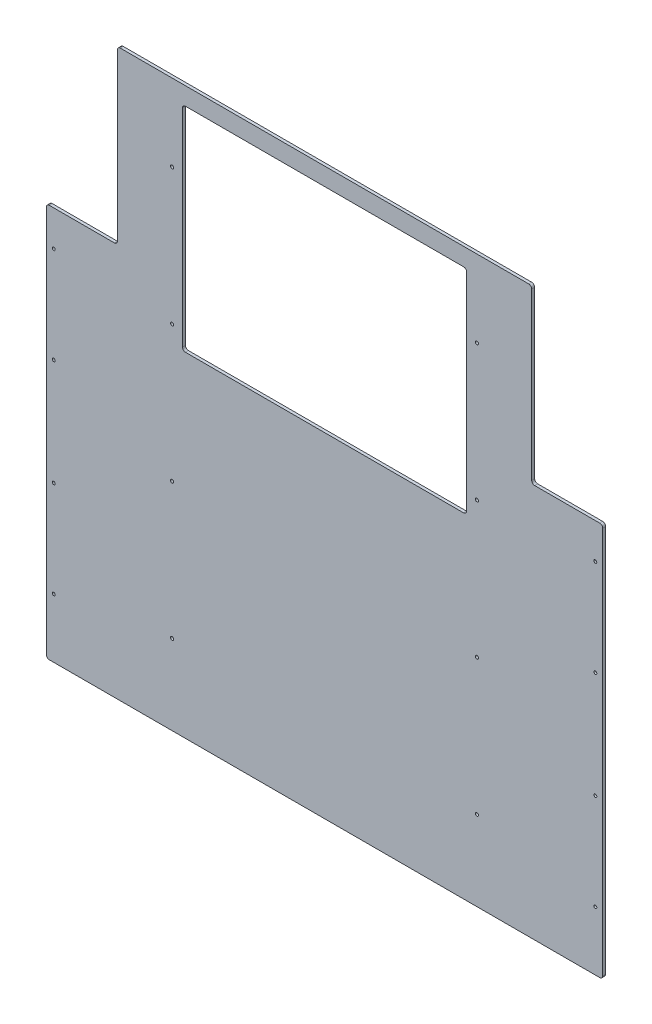
from build123d import *

# Parameters (mm, degrees)
SKETCH1_W                   = 1193.8
SKETCH1_H                   = 1212.85
BOSS_EXTRUDE1_DEPTH         = 6.35
SKETCH2_W                   = 609.6
SKETCH2_H                   = 457.2
CUT_EXTRUDE1_DEPTH          = 1702.823693865
SKETCH3_W                   = 152.4
SKETCH3_H                   = 330.2
CUT_EXTRUDE2_DEPTH          = 1702.823693865
F_1_4_0_25_DIAMETER_HOLE1_D = 6.35
F_1_4_CLEARANCE_HOLE1_D     = 6.7564
SKETCH8_W                   = 152.4
SKETCH8_H                   = 38.1
CUT_EXTRUDE3_DEPTH          = 1702.823693865
FILLET1_R                   = 6.35


with BuildPart() as part:
    # Sketch1 → Boss-Extrude1 (new body)
    with BuildSketch(Plane.XY):
        with Locations((596.9, 606.425)):
            Rectangle(SKETCH1_W, SKETCH1_H)
    extrude(amount=BOSS_EXTRUDE1_DEPTH)

    # Sketch2 → Cut-Extrude1 (cut, through all)
    with BuildSketch(Plane.XY.offset(6.35)):
        with Locations((596.9, 946.15)):
            Rectangle(SKETCH2_W, SKETCH2_H)
    extrude(amount=-CUT_EXTRUDE1_DEPTH, mode=Mode.SUBTRACT)

    # Sketch3 → Cut-Extrude2 (cut, through all)
    with BuildSketch(Plane.XY.offset(6.35)):
        with Locations((76.2, 1009.65)):
            Rectangle(SKETCH3_W, SKETCH3_H)
        with Locations((1117.6, 1009.65)):
            Rectangle(SKETCH3_W, SKETCH3_H)
    extrude(amount=-CUT_EXTRUDE2_DEPTH, mode=Mode.SUBTRACT)

    # 1/4 (0.25) Diameter Hole1 (through all)
    with Locations(Plane.XY.offset(6.35)):
        with Locations((15.875, 127), (15.875, 333.375), (15.875, 561.975), (15.875, 768.35), (1177.925, 768.35), (1177.925, 561.975), (1177.925, 333.375), (1177.925, 127)):
            Hole(F_1_4_0_25_DIAMETER_HOLE1_D / 2)

    # 1/4 Clearance Hole1 (through all)
    with Locations(Plane.XY.offset(6.35)):
        with Locations((923.925, 1047.75), (269.875, 1047.75), (269.875, 755.65), (269.875, 463.55), (269.875, 171.45), (923.925, 171.45), (923.925, 463.55), (923.925, 755.65)):
            Hole(F_1_4_CLEARANCE_HOLE1_D / 2)

    # Sketch8 → Cut-Extrude3 (cut, through all)
    with BuildSketch(Plane.XY.offset(6.35)):
        with Locations((76.2, 1193.8)):
            Rectangle(SKETCH8_W, SKETCH8_H)
        with Locations((1117.6, 1193.8)):
            Rectangle(SKETCH8_W, SKETCH8_H)
    extrude(amount=-CUT_EXTRUDE3_DEPTH, mode=Mode.SUBTRACT)

    # Fillet1
    fillet1_edges = [part.edges().sort_by_distance(p)[0] for p in [
        (152.4, 1212.85, 3.175),
        (1041.4, 1212.85, 3.175),
        (292.1, 717.55, 3.175),
        (292.1, 1174.75, 3.175),
        (901.7, 1174.75, 3.175),
        (901.7, 717.55, 3.175),
        (0, 844.55, 3.175),
        (152.4, 844.55, 3.175),
        (1193.8, 844.55, 3.175),
        (1041.4, 844.55, 3.175),
        (1193.8, 0, 3.175),
        (0, 0, 3.175),
    ]]
    fillet(fillet1_edges, radius=FILLET1_R)


solid = part.part
